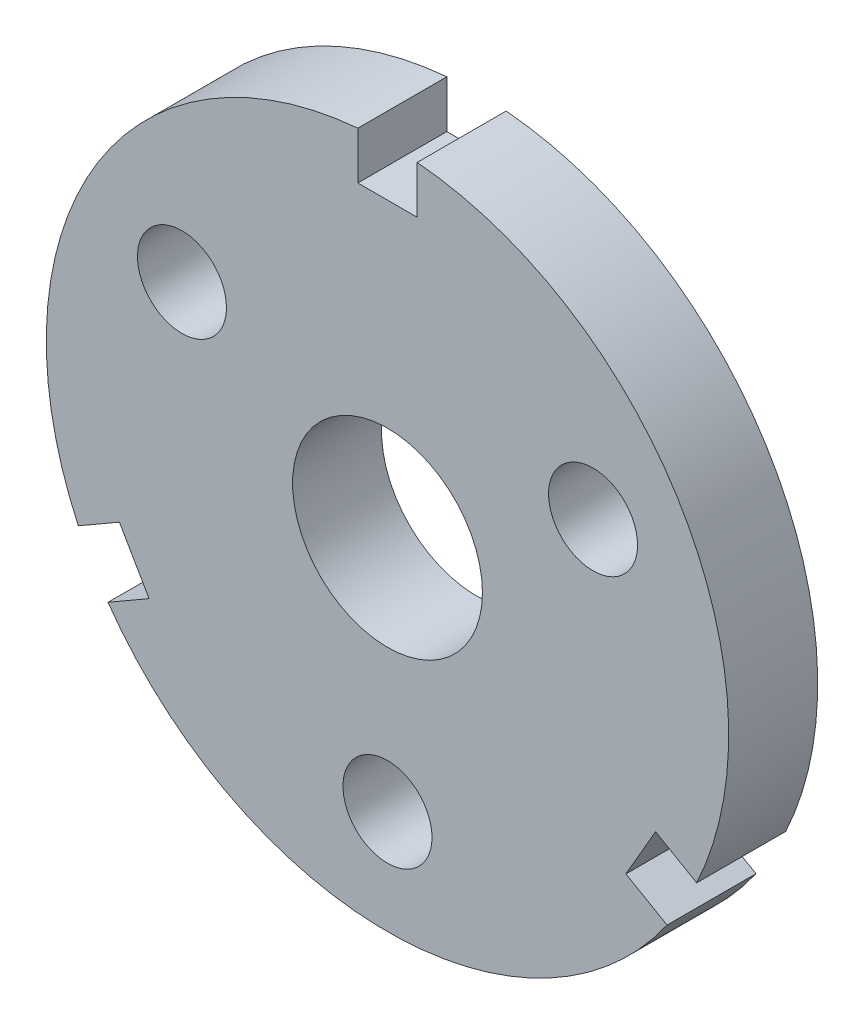
from build123d import *

# Parameters (mm, degrees)
SKETCH1_R           = 7.5
SKETCH1_R_2         = 16
BOSS_EXTRUDE1_DEPTH = 15


with BuildPart() as part:
    # Sketch1 → Boss-Extrude1 (new body)
    with BuildSketch(Plane.XY):
        with BuildLine():
            Line((-5, 49.282196187), (-5, 57.282196187))
            ThreePointArc((-5, 57.282196187), (-49.796460718, 28.75), (-52.107837082, -24.310971075))
            Line((-52.107837082, -24.310971075), (-45.179633852, -20.310971075))
            Line((-45.179633852, -20.310971075), (-40.179633852, -28.971225112))
            Line((-40.179633852, -28.971225112), (-47.107837082, -32.971225112))
            ThreePointArc((-47.107837082, -32.971225112), (0, -57.5), (47.107837082, -32.971225112))
            Line((47.107837082, -32.971225112), (40.179633852, -28.971225112))
            Line((40.179633852, -28.971225112), (45.179633852, -20.310971075))
            Line((45.179633852, -20.310971075), (52.107837082, -24.310971075))
            ThreePointArc((52.107837082, -24.310971075), (49.796460718, 28.75), (5, 57.282196187))
            Line((5, 57.282196187), (5, 49.282196187))
            Line((5, 49.282196187), (-5, 49.282196187))
        make_face()
        with Locations((0, -40)):
            Circle(SKETCH1_R, mode=Mode.SUBTRACT)
        with Locations((-34.641016151, 20)):
            Circle(SKETCH1_R, mode=Mode.SUBTRACT)
        Circle(SKETCH1_R_2, mode=Mode.SUBTRACT)
        with Locations((34.641016151, 20)):
            Circle(SKETCH1_R, mode=Mode.SUBTRACT)
    extrude(amount=BOSS_EXTRUDE1_DEPTH)


solid = part.part
